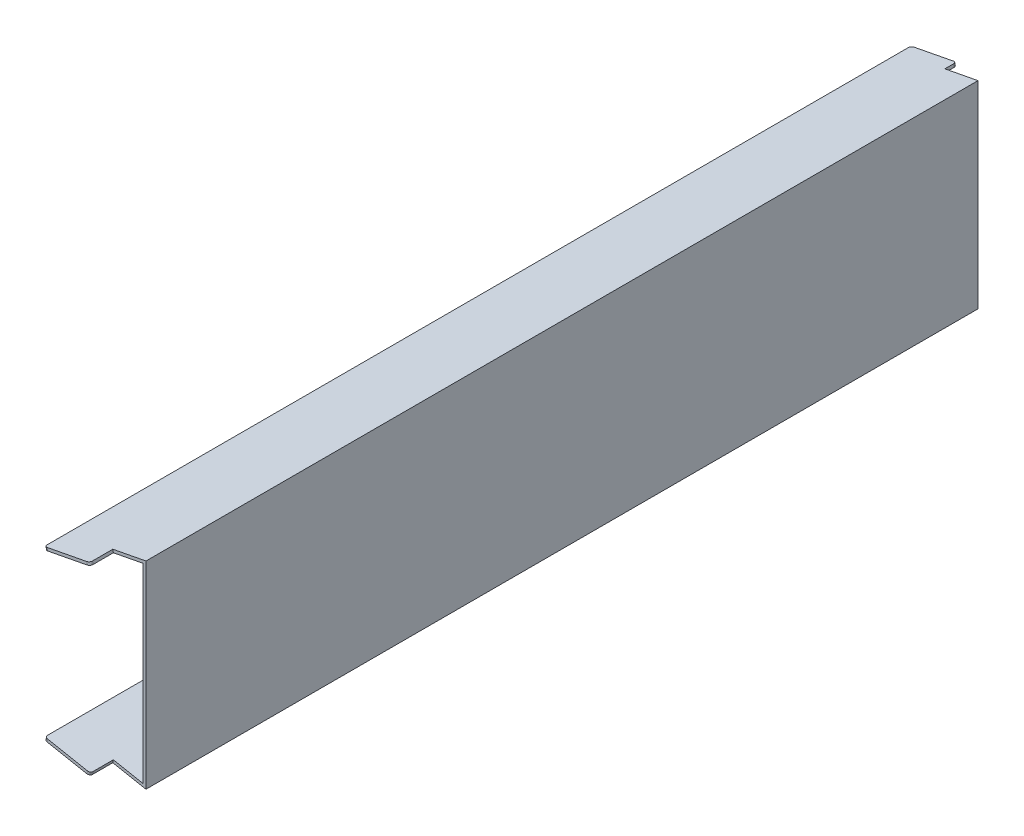
from build123d import *

# Parameters (mm, degrees)
BOSS_EXTRUDE1_DEPTH = 144
BOSS_EXTRUDE2_DEPTH = 0.5
BOSS_EXTRUDE3_DEPTH = 0.5


with BuildPart() as part:
    # Sketch1 → Boss-Extrude1 (new body)
    with BuildSketch(Plane.XY):
        Polygon((-13, 2.5), (0, 0), (0, 33), (-13, 30.5), (-13.094423697, 30.991003223), (0.5, 33.605315473), (0.5, -0.605315473), (-13.094423697, 2.008996777), align=None)
    extrude(amount=BOSS_EXTRUDE1_DEPTH)

    # Sketch2 → Boss-Extrude2 (add)
    with BuildSketch(Plane(origin=(-6.214252513, 32.314113067, 0), x_dir=(0.9820064469806473, 0.18884739365012462, 0), z_dir=(-0.18884739365012462, 0.9820064469806473, 0))):
        with BuildLine():
            Line((-7.006238304, 0), (-7.006238304, 1.5))
            ThreePointArc((-7.006238304, 1.5), (-6.859791695, 1.853553391), (-6.506238304, 2))
            Line((-6.506238304, 2), (0.493761696, 2))
            ThreePointArc((0.493761696, 2), (0.847315086, 1.853553391), (0.993761696, 1.5))
            Line((0.993761696, 1.5), (0.993761696, 0))
            Line((0.993761696, 0), (-7.006238304, 0))
        make_face()
        with BuildLine():
            Line((-7.006238304, -144), (-7.006238304, -147.5))
            ThreePointArc((-7.006238304, -147.5), (-6.859791695, -147.853553391), (-6.506238304, -148))
            Line((-6.506238304, -148), (0.493761696, -148))
            ThreePointArc((0.493761696, -148), (0.847315086, -147.853553391), (0.993761696, -147.5))
            Line((0.993761696, -147.5), (0.993761696, -144))
            Line((0.993761696, -144), (-7.006238304, -144))
        make_face()
    extrude(amount=-BOSS_EXTRUDE2_DEPTH)

    # Sketch3 → Boss-Extrude3 (add)
    with BuildSketch(Plane(origin=(-0.094423697, -0.491003223, 0), x_dir=(0.9820064469806474, -0.18884739365012435, 0), z_dir=(-0.18884739365012435, -0.9820064469806474, 0))):
        with BuildLine():
            Line((-13.238202295, 147.5), (-13.238202295, 144))
            Line((-13.238202295, 144), (-5.238202295, 144))
            Line((-5.238202295, 144), (-5.238202295, 147.5))
            ThreePointArc((-5.238202295, 147.5), (-5.384648904, 147.853553391), (-5.738202295, 148))
            Line((-5.738202295, 148), (-12.738202295, 148))
            ThreePointArc((-12.738202295, 148), (-13.091755685, 147.853553391), (-13.238202295, 147.5))
        make_face()
        with BuildLine():
            Line((-5.238202295, 0), (-13.238202295, 0))
            Line((-13.238202295, 0), (-13.238202295, -1.5))
            ThreePointArc((-13.238202295, -1.5), (-13.091755685, -1.853553391), (-12.738202295, -2))
            Line((-12.738202295, -2), (-5.738202295, -2))
            ThreePointArc((-5.738202295, -2), (-5.384648904, -1.853553391), (-5.238202295, -1.5))
            Line((-5.238202295, -1.5), (-5.238202295, 0))
        make_face()
    extrude(amount=-BOSS_EXTRUDE3_DEPTH)


solid = part.part
